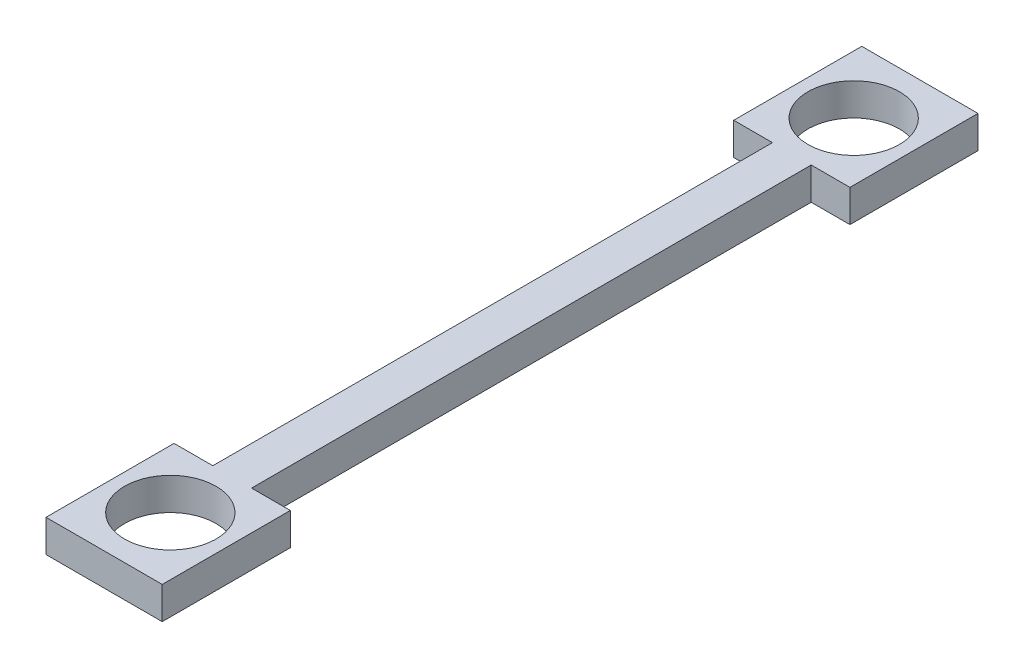
from build123d import *

# Parameters (mm, degrees)
BOSS_EXTRUDE1_DEPTH = 3
SKETCH2_R           = 4.25
CUT_EXTRUDE1_DEPTH  = 3
SKETCH3_W           = 10
SKETCH3_H           = 3
BOSS_EXTRUDE2_DEPTH = 0.4
SKETCH4_W           = 10
SKETCH4_H           = 3
BOSS_EXTRUDE3_DEPTH = 0.4
SKETCH5_W           = 11.9
SKETCH5_H           = 3
BOSS_EXTRUDE4_DEPTH = 0.4
SKETCH6_W           = 52
SKETCH6_H           = 3
BOSS_EXTRUDE5_DEPTH = 0.4
SKETCH7_W           = 11.9
SKETCH7_H           = 3
BOSS_EXTRUDE6_DEPTH = 0.4
SKETCH8_W           = 52
SKETCH8_H           = 3
BOSS_EXTRUDE7_DEPTH = 0.4
SKETCH9_W           = 52
SKETCH9_H           = 3
CUT_EXTRUDE2_DEPTH  = 0.1
SKETCH10_W          = 52
SKETCH10_H          = 3
CUT_EXTRUDE3_DEPTH  = 0.1


with BuildPart() as part:
    # Sketch1 → Boss-Extrude1 (new body)
    with BuildSketch(Plane(origin=(0, 0, 0), x_dir=(1, 0, 0), z_dir=(0, 1, 0))):
        Polygon((0, 11.5), (3.5, 11.5), (3.5, 63.5), (0, 63.5), (0, 75), (10, 75), (10, 63.5), (6.5, 63.5), (6.5, 11.5), (10, 11.5), (10, 0), (0, 0), align=None)
    extrude(amount=BOSS_EXTRUDE1_DEPTH)

    # Sketch2 → Cut-Extrude1 (cut)
    with BuildSketch(Plane(origin=(0, 3, 0), x_dir=(1, 0, 0), z_dir=(0, 1, 0))):
        with Locations(Location((5, 69.25, 0), (0, 0, 270))):
            Circle(SKETCH2_R)
        with Locations(Location((5, 5.75, 0), (0, 0, 90))):
            Circle(SKETCH2_R)
    extrude(amount=-CUT_EXTRUDE1_DEPTH, mode=Mode.SUBTRACT)

    # Sketch3 → Boss-Extrude2 (add)
    with BuildSketch(Plane.XY):
        with Locations((5, 1.5)):
            Rectangle(SKETCH3_W, SKETCH3_H)
    extrude(amount=BOSS_EXTRUDE2_DEPTH)

    # Sketch4 → Boss-Extrude3 (add)
    with BuildSketch(Plane(origin=(0, 0, -75), x_dir=(-1, 0, 0), z_dir=(0, 0, -1))):
        with Locations((-5, 1.5)):
            Rectangle(SKETCH4_W, SKETCH4_H)
    extrude(amount=BOSS_EXTRUDE3_DEPTH)

    # Sketch5 → Boss-Extrude4 (add)
    with BuildSketch(Plane(origin=(10, 0, 0), x_dir=(0, 0, -1), z_dir=(1, 0, 0))):
        with Locations((69.45, 1.5)):
            Rectangle(SKETCH5_W, SKETCH5_H)
        with Locations((5.55, 1.5)):
            Rectangle(SKETCH5_W, SKETCH5_H)
    extrude(amount=BOSS_EXTRUDE4_DEPTH)

    # Sketch6 → Boss-Extrude5 (add)
    with BuildSketch(Plane(origin=(6.5, 0, 0), x_dir=(0, 0, -1), z_dir=(1, 0, 0))):
        with Locations((37.5, 1.5)):
            Rectangle(SKETCH6_W, SKETCH6_H)
    extrude(amount=BOSS_EXTRUDE5_DEPTH)

    # Sketch7 → Boss-Extrude6 (add)
    with BuildSketch(Plane.ZY):
        with Locations((-5.55, 1.5)):
            Rectangle(SKETCH7_W, SKETCH7_H)
        with Locations((-69.45, 1.5)):
            Rectangle(SKETCH7_W, SKETCH7_H)
    extrude(amount=BOSS_EXTRUDE6_DEPTH)

    # Sketch8 → Boss-Extrude7 (add)
    with BuildSketch(Plane.ZY.offset(-3.5)):
        with Locations((-37.5, 1.5)):
            Rectangle(SKETCH8_W, SKETCH8_H)
    extrude(amount=BOSS_EXTRUDE7_DEPTH)

    # Sketch9 → Cut-Extrude2 (cut)
    with BuildSketch(Plane.ZY.offset(-3.1)):
        with Locations((-37.5, 1.5)):
            Rectangle(SKETCH9_W, SKETCH9_H)
    extrude(amount=-CUT_EXTRUDE2_DEPTH, mode=Mode.SUBTRACT)

    # Sketch10 → Cut-Extrude3 (cut)
    with BuildSketch(Plane(origin=(6.9, 0, 0), x_dir=(0, 0, -1), z_dir=(1, 0, 0))):
        with Locations((37.5, 1.5)):
            Rectangle(SKETCH10_W, SKETCH10_H)
    extrude(amount=-CUT_EXTRUDE3_DEPTH, mode=Mode.SUBTRACT)


solid = part.part
